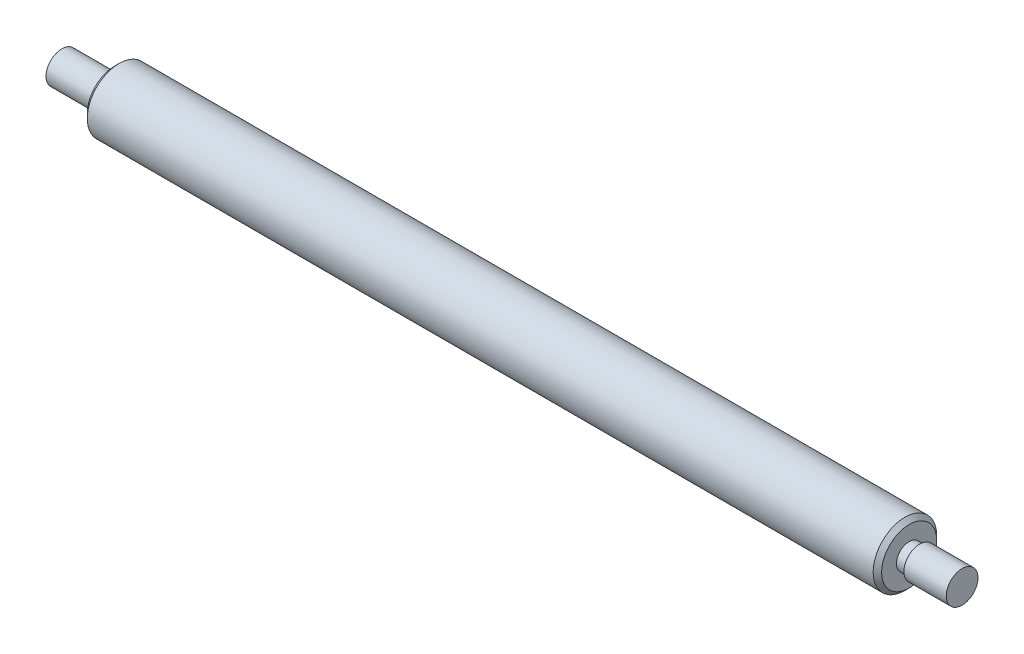
from build123d import *

# Parameters (mm, degrees)
SKETCH1_W     = 75
SKETCH1_H     = 3
CHAMFER1_SIZE = 0.4
SKETCH5_W     = 5
SKETCH5_H     = 1.5
FILLET3_R     = 0.5
CHAMFER4_SIZE = 0.4


with BuildPart() as part:
    # Sketch1 → Revolve1 (revolve)
    with BuildSketch(Plane.XY, mode=Mode.PRIVATE) as revolve1_sk:
        with Locations((37.5, 1.5)):
            Rectangle(SKETCH1_W, SKETCH1_H)
    revolve(revolve1_sk.sketch.rotate(Axis((0, 0, 0), (1, 0, 0)), 90), axis=Axis((0, 0, 0), (1, 0, 0)))

    # Chamfer1
    chamfer1_edges = [part.edges().sort_by_distance(p)[0] for p in [
        (0, 0, -3),
    ]]
    chamfer(chamfer1_edges, length=CHAMFER1_SIZE)

    # Sketch5 → Revolve4 (revolve)
    with BuildSketch(Plane.XY):
        Polygon((80, 0), (80, 1.5), (76, 1.5), (76, 1.2), (75, 1.2), (75, 0), align=None)
        with Locations((-2.5, 0.75)):
            Rectangle(SKETCH5_W, SKETCH5_H)
    revolve(axis=Axis((80, 0, 0), (-1, 0, 0)))

    # Fillet3
    fillet3_edges = [part.edges().sort_by_distance(p)[0] for p in [
        (0, -1.5, 0),
    ]]
    fillet(fillet3_edges, radius=FILLET3_R)

    # Chamfer4
    chamfer4_edges = [part.edges().sort_by_distance(p)[0] for p in [
        (75, 0, -3),
    ]]
    chamfer(chamfer4_edges, length=CHAMFER4_SIZE)


solid = part.part
